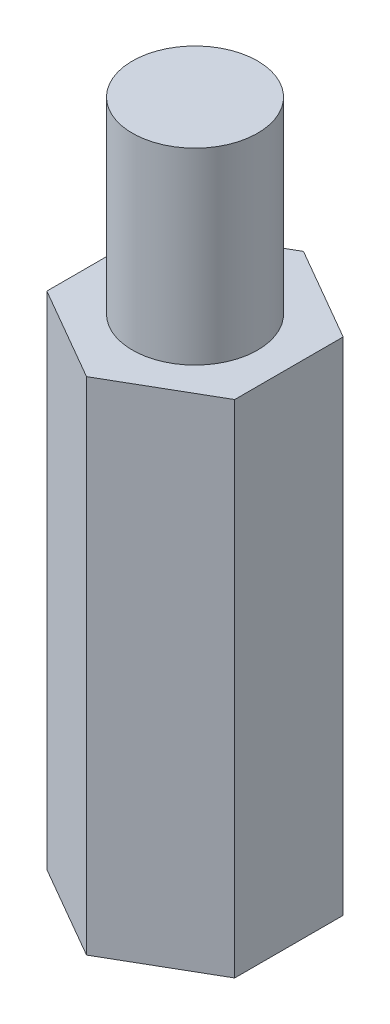
from build123d import *

# Parameters (mm, degrees)
BOSS_EXTRUDE1_DEPTH = 25.4
SKETCH2_R           = 3.175
CUT_EXTRUDE1_DEPTH  = 12.7
SKETCH3_R           = 3.175
BOSS_EXTRUDE2_DEPTH = 9.525


with BuildPart() as part:
    # Sketch1 → Boss-Extrude1 (new body)
    with BuildSketch(Plane(origin=(0, 0, 0), x_dir=(1, 0, 0), z_dir=(0, 1, 0))):
        Polygon((0, 5.499261314), (-4.7625, 2.749630657), (-4.7625, -2.749630657), (0, -5.499261314), (4.7625, -2.749630657), (4.7625, 2.749630657), align=None)
    extrude(amount=BOSS_EXTRUDE1_DEPTH)

    # Sketch2 → Cut-Extrude1 (cut)
    with BuildSketch(Plane.XZ):
        with Locations(Location((0, 0, 0), (0, 0, 270))):
            Circle(SKETCH2_R)
    extrude(amount=-CUT_EXTRUDE1_DEPTH, mode=Mode.SUBTRACT)

    # Sketch3 → Boss-Extrude2 (add)
    with BuildSketch(Plane(origin=(0, 25.4, 0), x_dir=(1, 0, 0), z_dir=(0, 1, 0))):
        with Locations(Location((0, 0, 0), (0, 0, 90))):
            Circle(SKETCH3_R)
    extrude(amount=BOSS_EXTRUDE2_DEPTH)


solid = part.part
